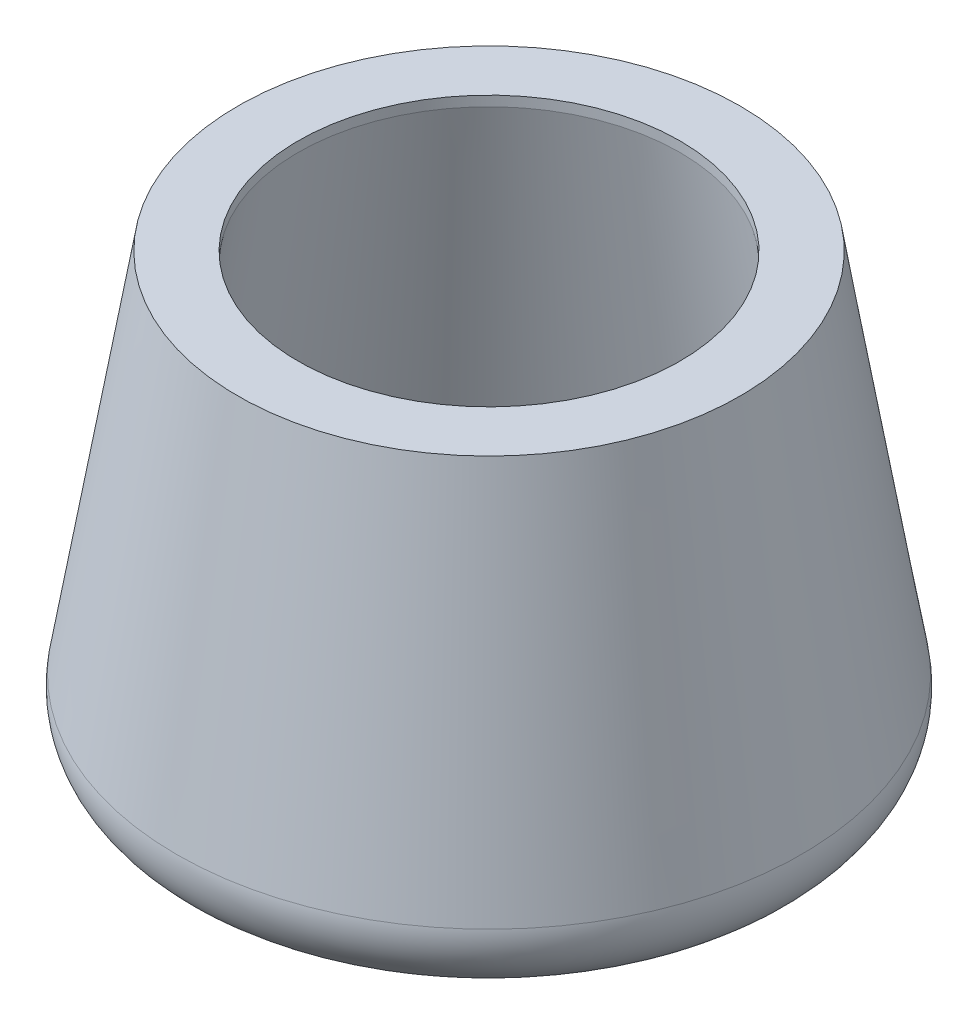
from build123d import *


with BuildPart() as part:
    # Sketch1 → Revolve1 (revolve)
    with BuildSketch(Plane.XY, mode=Mode.PRIVATE) as revolve1_sk:
        with BuildLine():
            Line((10.4775, 0), (0, 0))
            Line((0, 0), (0, -2.54))
            Line((0, -2.54), (10.4775, -2.54))
            ThreePointArc((10.4775, -2.54), (12.415570755, -1.641792236), (12.982940567, 0.417573428))
            Line((12.982940567, 0.417573428), (10.442940567, 15.657573428))
            Line((10.442940567, 15.657573428), (7.9375, 15.657573428))
            Line((7.9375, 15.657573428), (7.9375, 15.24))
            Line((7.9375, 15.24), (10.4775, 0))
        make_face()
    revolve(revolve1_sk.sketch.rotate(Axis((0, 0, 0), (0, 1, 0)), 90), axis=Axis((0, 0, 0), (0, 1, 0)))


solid = part.part
